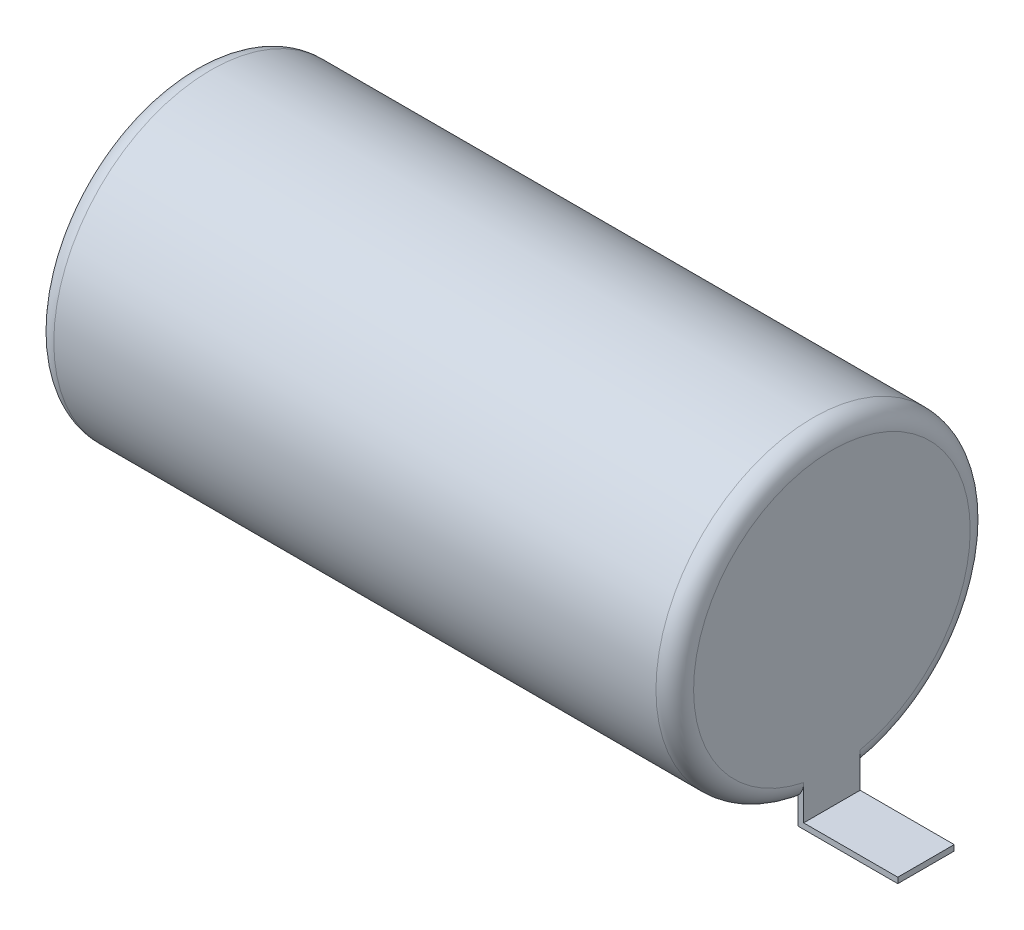
from build123d import *

# Parameters (mm, degrees)
SKETCH_1_R      = 8.35
EXTRUDE_1_DEPTH = 17
FILLET_1_R      = 1
EXTRUDE_2_DEPTH = 0.3
SKETCH_3_W      = 3
SKETCH_3_H      = 0.3
EXTRUDE_3_DEPTH = 5


with BuildPart() as part:
    # Эскиз1 → Бобышка-Вытянуть1 (new, symmetric)
    with BuildSketch(Plane(origin=(0, 0, 0), x_dir=(0, 0, -1), z_dir=(1, 0, 0))):
        Circle(SKETCH_1_R)
    extrude(amount=EXTRUDE_1_DEPTH, both=True)

    # Скругление1
    fillet_1_edges = [part.edges().sort_by_distance(p)[0] for p in [
        (-17, 0, 8.35),
        (17, 0, 8.35),
    ]]
    fillet(fillet_1_edges, radius=FILLET_1_R)

    # Эскиз2 → Бобышка-Вытянуть2 (add)
    with BuildSketch(Plane(origin=(17, 0, 0), x_dir=(0, 0, -1), z_dir=(1, 0, 0))):
        with BuildLine():
            Line((-1.5, -9.35), (1.5, -9.35))
            Line((1.5, -9.35), (1.5, -7.195310973))
            ThreePointArc((1.5, -7.195310973), (0, -7.35), (-1.5, -7.195310973))
            Line((-1.5, -7.195310973), (-1.5, -9.35))
        make_face()
    extrude_2 = extrude(amount=-EXTRUDE_2_DEPTH)

    # Эскиз3 → Бобышка-Вытянуть3 (add)
    with BuildSketch(Plane(origin=(17, 0, 0), x_dir=(0, 0, -1), z_dir=(1, 0, 0))):
        with Locations((0, -9.2)):
            Rectangle(SKETCH_3_W, SKETCH_3_H)
    extrude_3 = extrude(amount=EXTRUDE_3_DEPTH)

    # Зеркальное отражение1: Бобышка-Вытянуть2, Бобышка-Вытянуть3 across plane
    add(extrude_2.mirror(Plane(origin=(0, 0, 0), x_dir=(0, 0, 1), z_dir=(1, 0, 0))))
    add(extrude_3.mirror(Plane(origin=(0, 0, 0), x_dir=(0, 0, 1), z_dir=(1, 0, 0))))


solid = part.part
